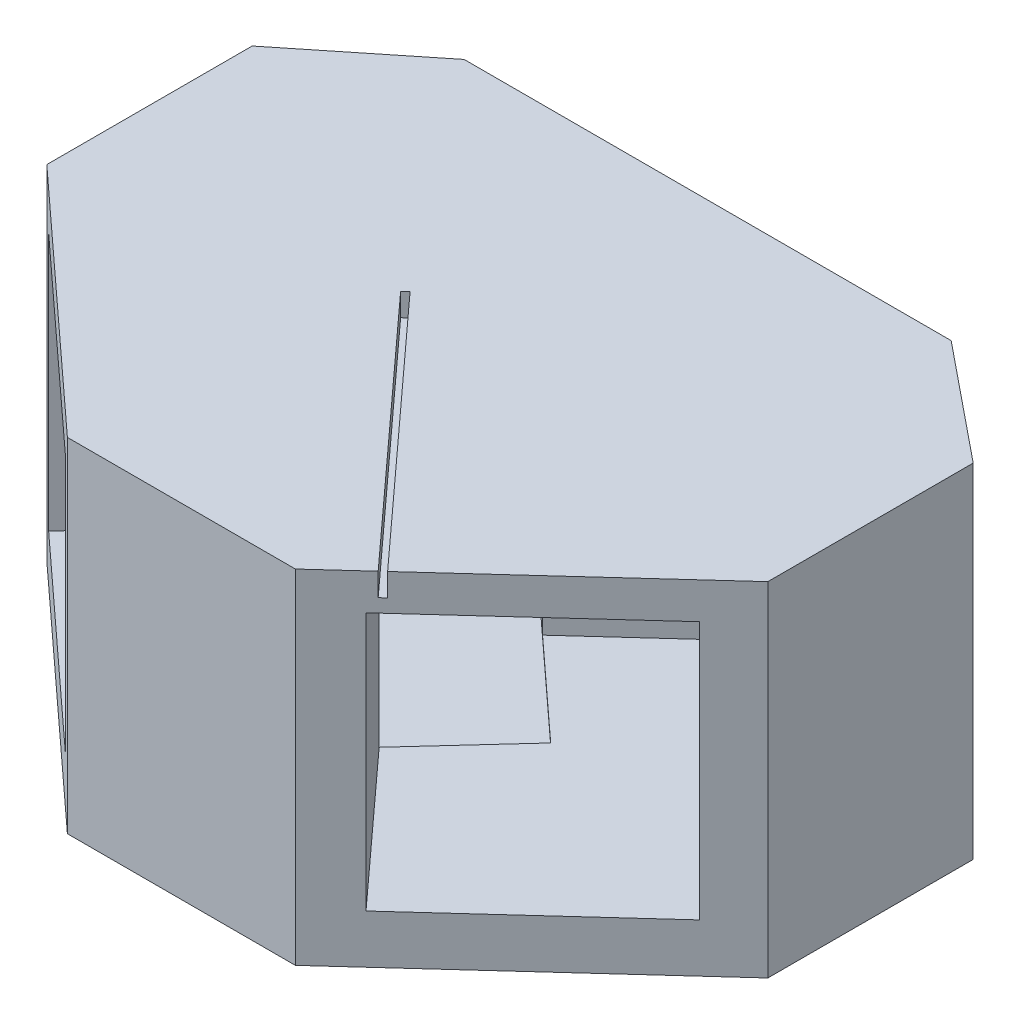
from build123d import *

# Parameters (mm, degrees)
BOSS_EXTRUDE3_DEPTH = 117
SKETCH3_W           = 2.281994321
SKETCH3_H           = 23.79794077
SKETCH3_W_2         = 80.521799592
SKETCH3_H_2         = 88.019780931
CUT_EXTRUDE1_DEPTH  = 117
SKETCH4_W           = 94.510648664
SKETCH4_H           = 87.992672894
CUT_EXTRUDE2_DEPTH  = 117


with BuildPart() as part:
    # Sketch2 → Boss-Extrude3 (new body)
    with BuildSketch(Plane(origin=(0, 0, 0), x_dir=(1, 0, 0), z_dir=(0, 1, 0))):
        Polygon((-826.128986822, -44.396477746), (-786.035151567, -12.233698412), (-620.035151567, -12.233698412), (-580.129096878, -44.629173391), (-580.129096878, -114.629173391), (-664.384727068, -191.421027004), (-742.086028689, -191.421027004), (-826.128986822, -114.396477746), align=None)
    extrude(amount=BOSS_EXTRUDE3_DEPTH)

    # Sketch3 → Cut-Extrude1 (cut)
    with BuildSketch(Plane(origin=(-206.167073408, 0, -226.205461612), x_dir=(0.7390844753537593, 0, -0.6736127509860976), z_dir=(0.6736127509860976, 0, 0.7390844753537593))):
        with Locations((-598.858942552, 121.091844218)):
            Rectangle(SKETCH3_W, SKETCH3_H)
        with Locations((-562.673032613, 60.618994727)):
            Rectangle(SKETCH3_W_2, SKETCH3_H_2)
    extrude(amount=-CUT_EXTRUDE1_DEPTH, mode=Mode.SUBTRACT)

    # Sketch4 → Cut-Extrude2 (cut)
    with BuildSketch(Plane(origin=(-434.116139586, 0, 473.672418674), x_dir=(0.7372189309889005, 0, 0.6756539408540315), z_dir=(-0.6756539408540315, 0, 0.7372189309889005))):
        with Locations((-474.328289605, 59.966544548)):
            Rectangle(SKETCH4_W, SKETCH4_H)
    extrude(amount=-CUT_EXTRUDE2_DEPTH, mode=Mode.SUBTRACT)


solid = part.part
